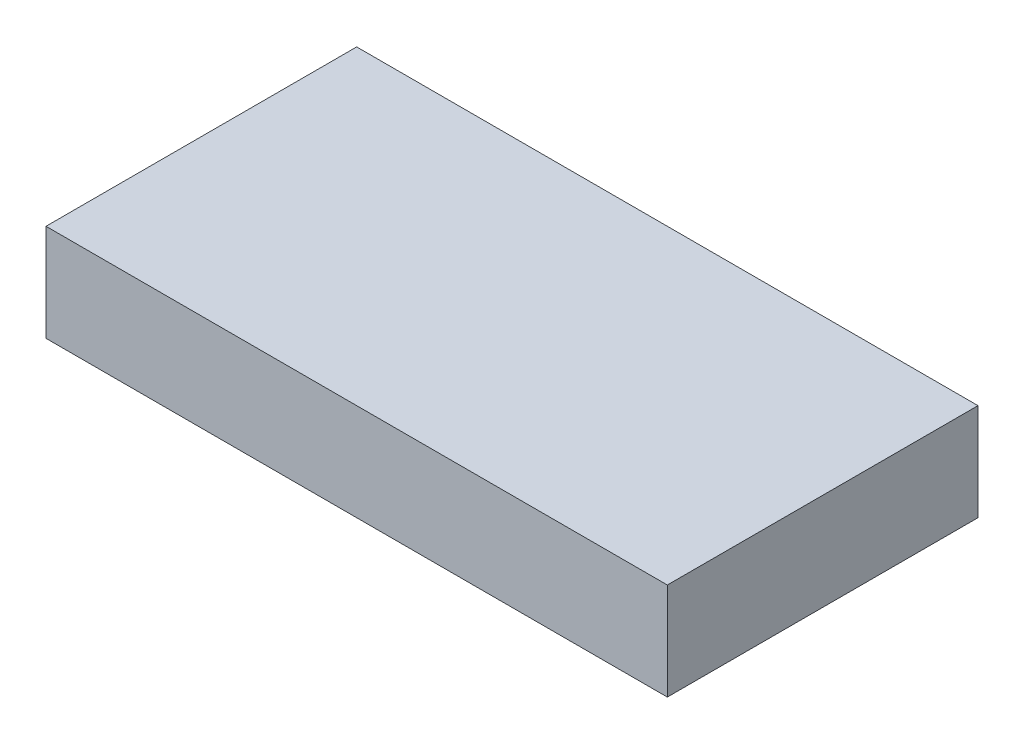
from build123d import *

# Parameters (mm, degrees)
SKETCH1_W           = 32
SKETCH1_H           = 16
BOSS_EXTRUDE1_DEPTH = 5


with BuildPart() as part:
    # Sketch1 → Boss-Extrude1 (new body)
    with BuildSketch(Plane(origin=(0, 0, 0), x_dir=(1, 0, 0), z_dir=(0, 1, 0))):
        with Locations((-1.41697417, 5.431734317)):
            Rectangle(SKETCH1_W, SKETCH1_H)
    extrude(amount=BOSS_EXTRUDE1_DEPTH)


solid = part.part
